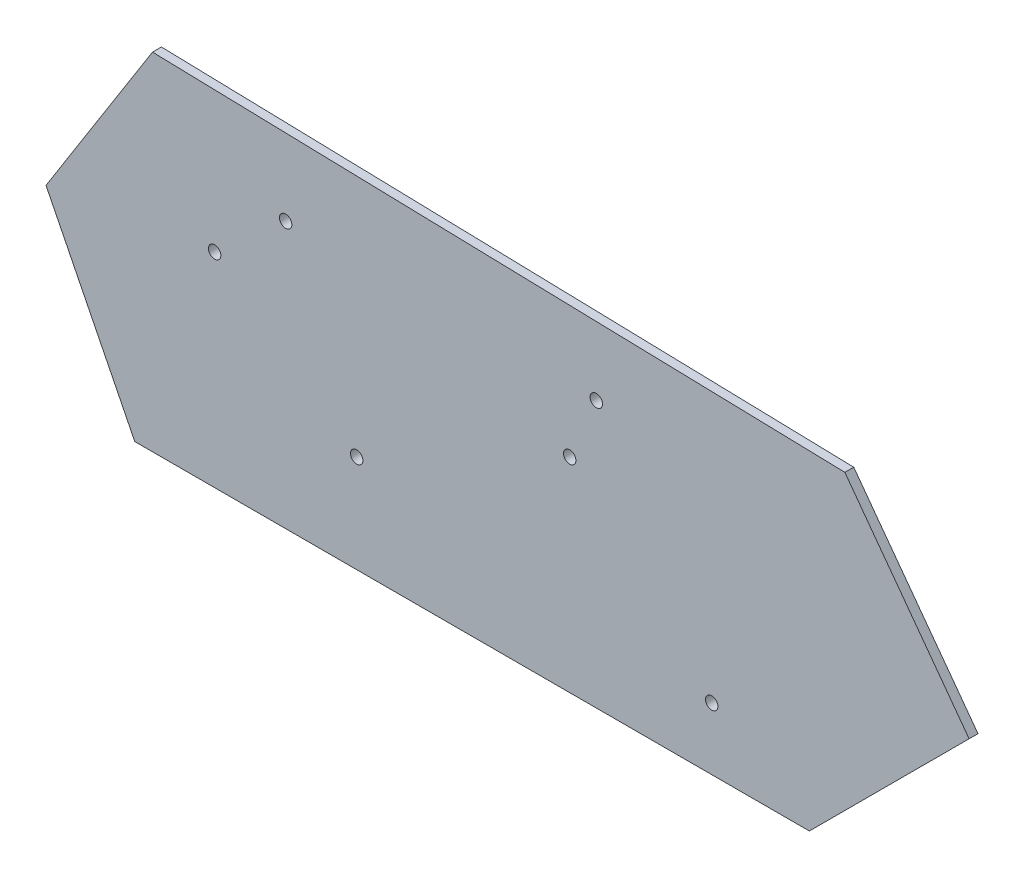
from build123d import *

# Parameters (mm, degrees)
SKETCH_1_R      = 3.5
EXTRUDE_1_DEPTH = 5


with BuildPart() as part:
    # 草图1 → 凸台-拉伸1 (new body)
    with BuildSketch(Plane.XY):
        Polygon((-175, 45), (-125, -55), (255, -55), (345, 35), (275, 130), (-115, 140), align=None)
        Circle(SKETCH_1_R, mode=Mode.SUBTRACT)
        with Locations((-80, 60)):
            Circle(SKETCH_1_R, mode=Mode.SUBTRACT)
        with Locations((120, 60)):
            Circle(SKETCH_1_R, mode=Mode.SUBTRACT)
        with Locations((200, -20)):
            Circle(SKETCH_1_R, mode=Mode.SUBTRACT)
        with Locations((-40, 95)):
            Circle(SKETCH_1_R, mode=Mode.SUBTRACT)
        with Locations((135, 95)):
            Circle(SKETCH_1_R, mode=Mode.SUBTRACT)
    extrude(amount=EXTRUDE_1_DEPTH)


solid = part.part
